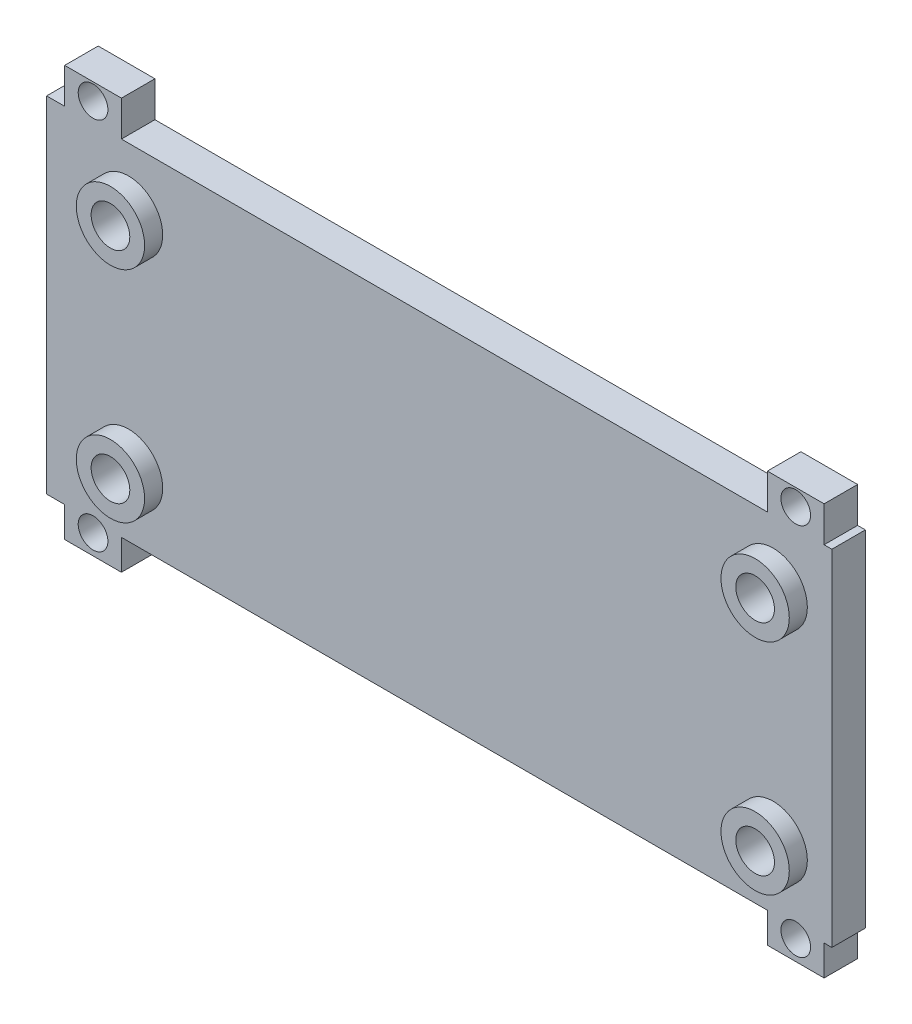
from build123d import *

# Parameters (mm, degrees)
PROFILE_R         = 1.15
PROFILE_R_2       = 1.5
EXTRUDE_266_DEPTH = 2.6
EXTRUDE_START     = 2.6
PROFILE_2_R       = 2.65
PROFILE_2_R_2     = 1.5
EXTRUDE_339_DEPTH = 1.4


with BuildPart() as part:
    # profile → Extrude 266 (new body)
    with BuildSketch(Plane.XY):
        Polygon((-43.1, 4), (-41.7, 4), (-41.7, 1.65), (-37.3, 1.65), (-37.3, 4), (12.8, 4), (12.8, 1.65), (17.2, 1.65), (17.2, 4), (17.8, 4), (17.8, 30.75), (17.2, 30.75), (17.2, 33.5), (12.8, 33.5), (12.8, 30.75), (-37.3, 30.75), (-37.3, 33.5), (-41.7, 33.5), (-41.7, 30.75), (-43.1, 30.75), align=None)
        with Locations((-39.5, 3.2)):
            Circle(PROFILE_R, mode=Mode.SUBTRACT)
        with Locations((15, 3.2)):
            Circle(PROFILE_R, mode=Mode.SUBTRACT)
        with Locations((-39.5, 32.2)):
            Circle(PROFILE_R, mode=Mode.SUBTRACT)
        with Locations((15, 32.2)):
            Circle(PROFILE_R, mode=Mode.SUBTRACT)
        with Locations((-36.75, 8.9)):
            Circle(PROFILE_R_2, mode=Mode.SUBTRACT)
        with Locations((13.25, 8.9)):
            Circle(PROFILE_R_2, mode=Mode.SUBTRACT)
        with Locations((-36.75, 25.9)):
            Circle(PROFILE_R_2, mode=Mode.SUBTRACT)
        with Locations((13.25, 25.9)):
            Circle(PROFILE_R_2, mode=Mode.SUBTRACT)
    extrude(amount=EXTRUDE_266_DEPTH)

    # profile 2 → Extrude 339 (add)
    # profile 1 of 4: a face of its own
    with BuildSketch(Plane.XY.offset(EXTRUDE_START)):
        with Locations((-36.75, 8.9)):
            Circle(PROFILE_2_R)
        with Locations((-36.75, 8.9)):
            Circle(PROFILE_2_R_2, mode=Mode.SUBTRACT)
    # profile 2 of 4: a face of its own
    with BuildSketch(Plane.XY.offset(EXTRUDE_START)):
        with Locations((13.25, 8.9)):
            Circle(PROFILE_2_R)
        with Locations((13.25, 8.9)):
            Circle(PROFILE_2_R_2, mode=Mode.SUBTRACT)
    # profile 3 of 4: a face of its own
    with BuildSketch(Plane.XY.offset(EXTRUDE_START)):
        with Locations((-36.75, 25.9)):
            Circle(PROFILE_2_R)
        with Locations((-36.75, 25.9)):
            Circle(PROFILE_2_R_2, mode=Mode.SUBTRACT)
    # profile 4 of 4: a face of its own
    with BuildSketch(Plane.XY.offset(EXTRUDE_START)):
        with Locations((13.25, 25.9)):
            Circle(PROFILE_2_R)
        with Locations((13.25, 25.9)):
            Circle(PROFILE_2_R_2, mode=Mode.SUBTRACT)
    extrude(amount=EXTRUDE_339_DEPTH)


solid = part.part
